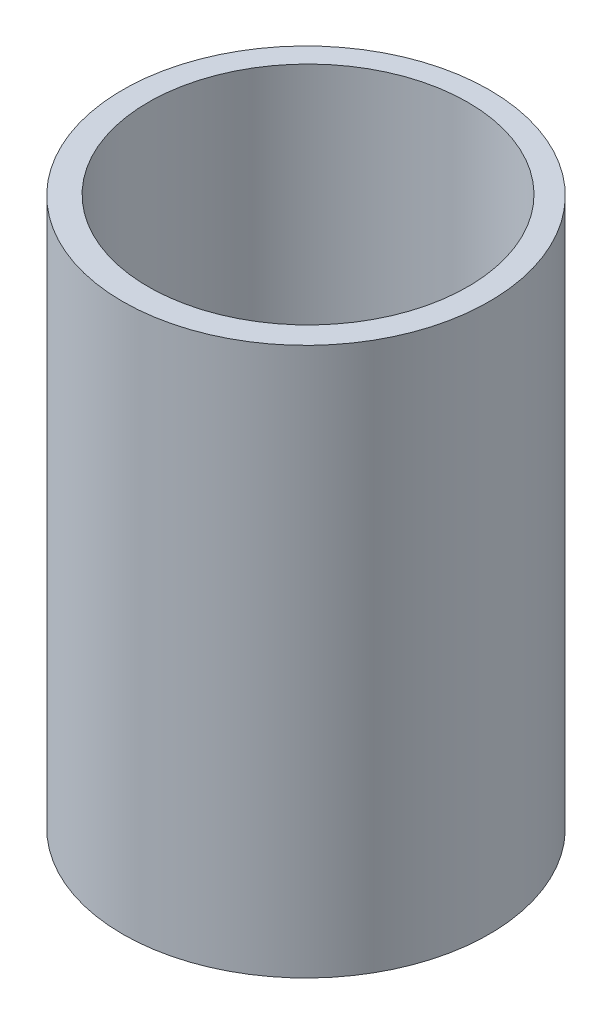
from build123d import *

# Parameters (mm, degrees)
SKETCH1_R           = 51
SKETCH1_R_2         = 44.45
BOSS_EXTRUDE1_DEPTH = 152.4


with BuildPart() as part:
    # Sketch1 → Boss-Extrude1 (new body)
    with BuildSketch(Plane(origin=(0, 0, 0), x_dir=(1, 0, 0), z_dir=(0, 1, 0))):
        with Locations(Location((0, 0, 0), (0, 0, 90))):
            Circle(SKETCH1_R)
        with Locations(Location((0, 0.566986597, 0), (0, 0, 90))):
            Circle(SKETCH1_R_2, mode=Mode.SUBTRACT)
    extrude(amount=BOSS_EXTRUDE1_DEPTH)


solid = part.part
